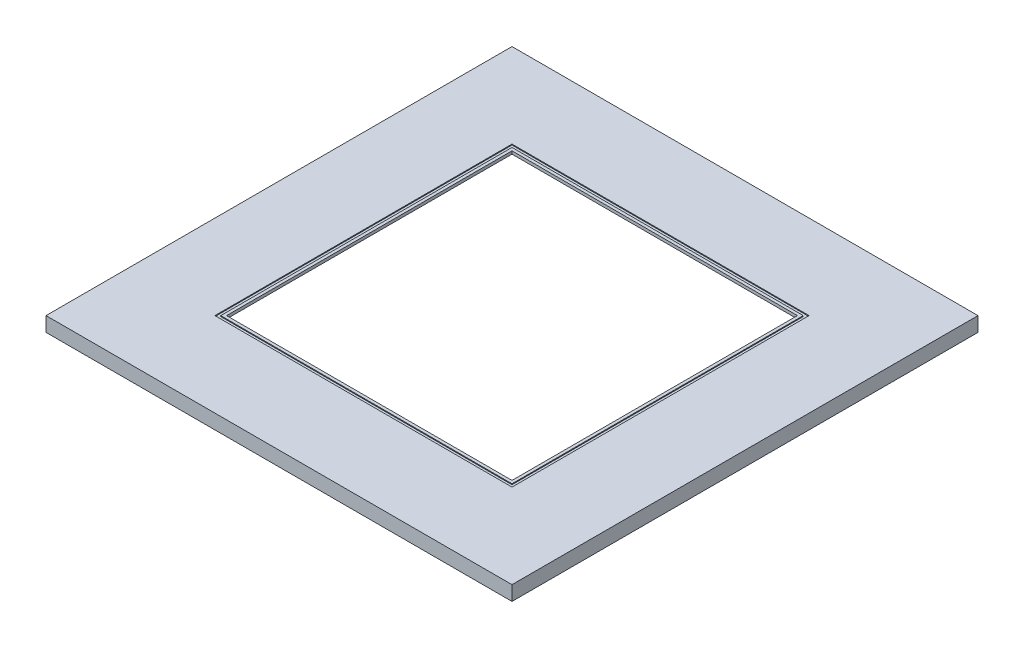
from build123d import *

# Parameters (mm, degrees)
CROQUIS1_W              = 160
CROQUIS1_H              = 160
CROQUIS1_W_2            = 150
CROQUIS1_H_2            = 150
SALIENTE_EXTRUIR1_DEPTH = 5
CROQUIS2_W              = 150
CROQUIS2_H              = 150
CROQUIS2_W_2            = 98
CROQUIS2_H_2            = 98
SALIENTE_EXTRUIR2_DEPTH = 1
CROQUIS3_W              = 102
CROQUIS3_H              = 102
CROQUIS3_W_2            = 100
CROQUIS3_H_2            = 100
CORTAR_EXTRUIR1_DEPTH   = 0.3


with BuildPart() as part:
    # Croquis1 → Saliente-Extruir1 (new body)
    with BuildSketch(Plane(origin=(0, 0, 0), x_dir=(1, 0, 0), z_dir=(0, 1, 0))):
        with Locations((75, 75)):
            Rectangle(CROQUIS1_W, CROQUIS1_H)
        with Locations((75, 75)):
            Rectangle(CROQUIS1_W_2, CROQUIS1_H_2, mode=Mode.SUBTRACT)
    extrude(amount=SALIENTE_EXTRUIR1_DEPTH)

    # Croquis2 → Saliente-Extruir2 (add)
    with BuildSketch(Plane(origin=(0, 5, 0), x_dir=(1, 0, 0), z_dir=(0, 1, 0))):
        with Locations((75, 75)):
            Rectangle(CROQUIS2_W, CROQUIS2_H)
        with Locations((75, 75)):
            Rectangle(CROQUIS2_W_2, CROQUIS2_H_2, mode=Mode.SUBTRACT)
    extrude(amount=-SALIENTE_EXTRUIR2_DEPTH)

    # Croquis3 → Cortar-Extruir1 (cut)
    with BuildSketch(Plane(origin=(0, 5, 0), x_dir=(1, 0, 0), z_dir=(0, 1, 0))):
        with Locations((75, 75)):
            Rectangle(CROQUIS3_W, CROQUIS3_H)
        with Locations((75, 75)):
            Rectangle(CROQUIS3_W_2, CROQUIS3_H_2, mode=Mode.SUBTRACT)
    extrude(amount=-CORTAR_EXTRUIR1_DEPTH, mode=Mode.SUBTRACT)


solid = part.part
